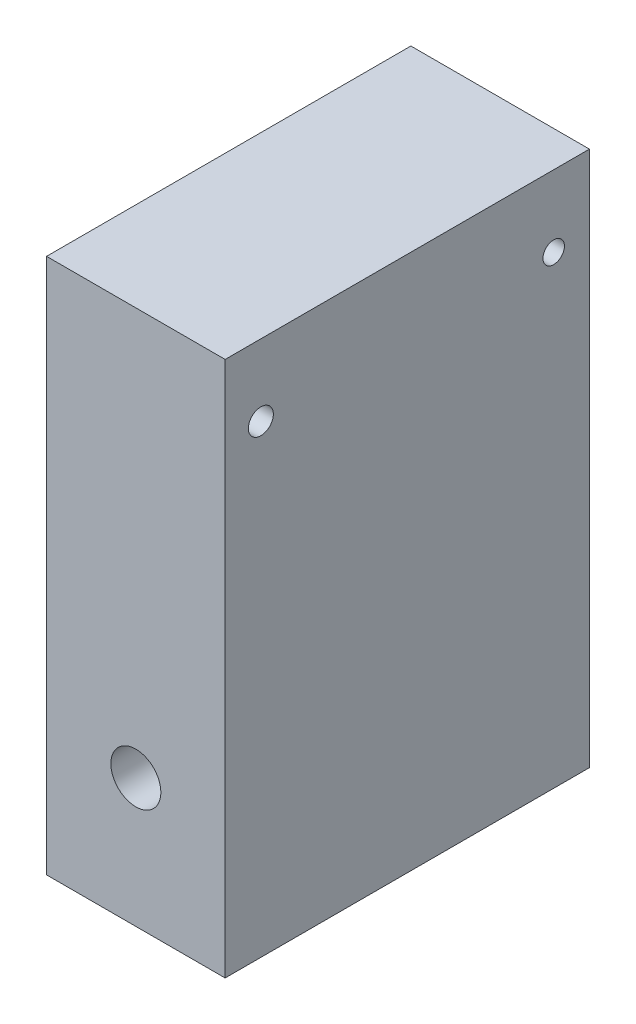
from build123d import *

# Parameters (mm, degrees)
ESQUISSE1_W             = 25
ESQUISSE1_H             = 75
BOSS_EXTRU_1_DEPTH      = 51
ESQUISSE2_R             = 3.5
ENL_V_MAT_EXTRU_1_DEPTH = 70
ESQUISSE3_W             = 15
ESQUISSE3_H             = 41
ENL_V_MAT_EXTRU_2_DEPTH = 29
ESQUISSE4_R             = 1.75
ESQUISSE4_R_2           = 1.5
ENL_V_MAT_EXTRU_3_DEPTH = 25


with BuildPart() as part:
    # Esquisse1 → Boss.-Extru.1 (new body)
    with BuildSketch(Plane.XY):
        with Locations((5.975, -32.109782609)):
            Rectangle(ESQUISSE1_W, ESQUISSE1_H)
    extrude(amount=BOSS_EXTRU_1_DEPTH)

    # Esquisse2 → Enlèv. mat.-Extru.1 (cut)
    with BuildSketch(Plane.XY.offset(51)):
        with Locations((5.975, -51.609782609)):
            Circle(ESQUISSE2_R)
    extrude(amount=-ENL_V_MAT_EXTRU_1_DEPTH, mode=Mode.SUBTRACT)

    # Esquisse3 → Enlèv. mat.-Extru.2 (cut)
    with BuildSketch(Plane.XZ.offset(69.609782609)):
        with Locations((5.975, 25.5)):
            Rectangle(ESQUISSE3_W, ESQUISSE3_H)
    extrude(amount=-ENL_V_MAT_EXTRU_2_DEPTH, mode=Mode.SUBTRACT)

    # Esquisse4 → Enlèv. mat.-Extru.3 (cut)
    with BuildSketch(Plane(origin=(18.475, 0, 0), x_dir=(0, 0, -1), z_dir=(1, 0, 0))):
        with Locations(Location((-46, -4.609782609, 0), (0, 0, 90))):
            Circle(ESQUISSE4_R)
        with Locations(Location((-5, -4.609782609, 0), (0, 0, 90))):
            Circle(ESQUISSE4_R_2)
    extrude(amount=-ENL_V_MAT_EXTRU_3_DEPTH, mode=Mode.SUBTRACT)


solid = part.part
